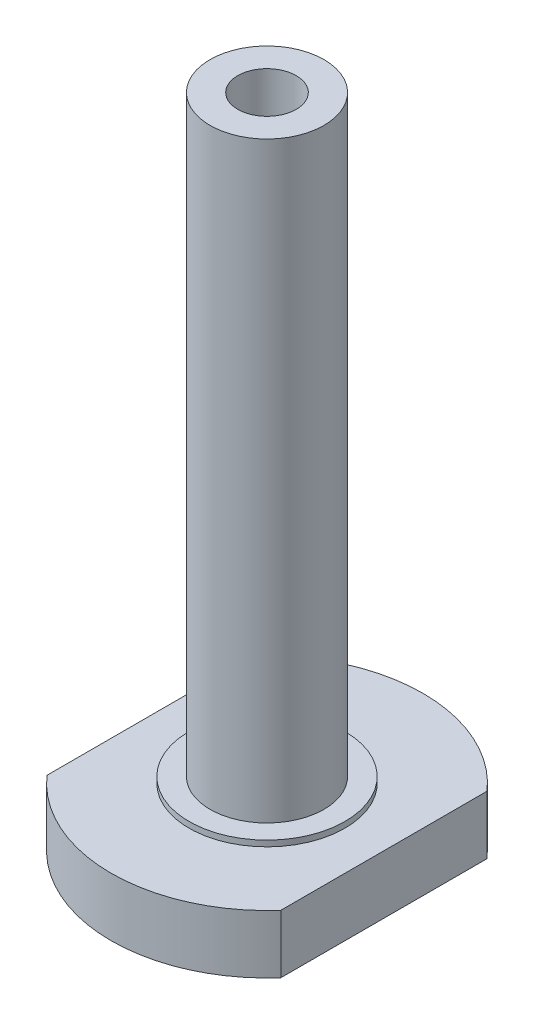
from build123d import *

# Parameters (mm, degrees)
ENL_V_MAT_EXTRU_1_REACH = 37.548


with BuildPart() as part:
    # Esquisse1 → Révolution1 (revolve)
    with BuildSketch(Plane.XY, mode=Mode.PRIVATE) as r_volution1_sk:
        Polygon((-1.5, 0), (-1.5, 33.7), (-2.925, 33.7), (-2.925, 3.3), (-4, 3.3), (-4, 3), (-8, 3), (-8, 0), align=None)
    revolve(r_volution1_sk.sketch.rotate(Axis((0, -3.664645975, 0), (0, 1, 0)), 270), axis=Axis((0, -3.664645975, 0), (0, 1, 0)))

    # Esquisse2 → Enlèv. mat.-Extru.1 (cut, up to next)
    with BuildSketch(Plane.XZ, mode=Mode.PRIVATE) as enl_v_mat_extru_1_sk1:
        with BuildLine():
            ThreePointArc((8, 0), (7.483314774, 2.828427125), (6, 5.291502622))
            Line((6, 5.291502622), (6, -5.291502622))
            ThreePointArc((6, -5.291502622), (7.483314774, -2.828427125), (8, 0))
        make_face()
    enl_v_mat_extru_1_tool1 = extrude(enl_v_mat_extru_1_sk1.sketch, amount=-ENL_V_MAT_EXTRU_1_REACH, mode=Mode.PRIVATE) & part.part
    # Esquisse2 → Enlèv. mat.-Extru.1 (cut, up to next)
    with BuildSketch(Plane.XZ, mode=Mode.PRIVATE) as enl_v_mat_extru_1_sk2:
        with BuildLine():
            Line((-6, -5.291502622), (-6, 5.291502622))
            ThreePointArc((-6, 5.291502622), (-8, 0), (-6, -5.291502622))
        make_face()
    enl_v_mat_extru_1_tool2 = extrude(enl_v_mat_extru_1_sk2.sketch, amount=-ENL_V_MAT_EXTRU_1_REACH, mode=Mode.PRIVATE) & part.part
    add(enl_v_mat_extru_1_tool1.solids().sort_by_distance((6.809243, 0, 0))[0], mode=Mode.SUBTRACT)
    add(enl_v_mat_extru_1_tool2.solids().sort_by_distance((-6.809243, 0, 0))[0], mode=Mode.SUBTRACT)


solid = part.part
